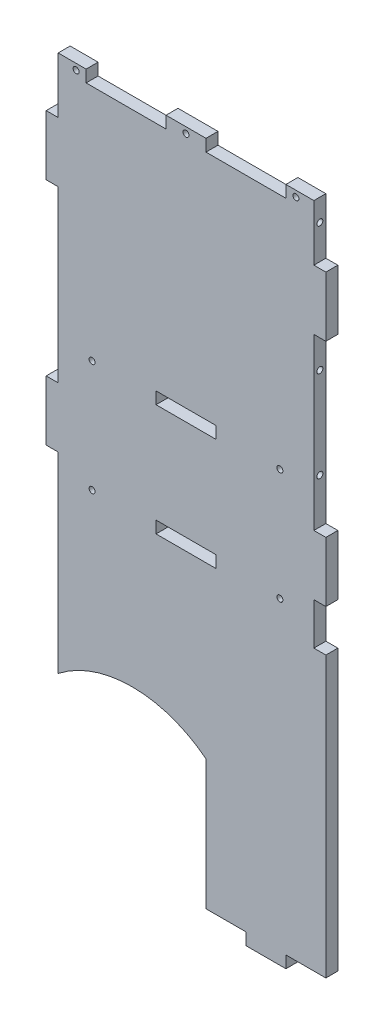
from build123d import *

# Parameters (mm, degrees)
ESQUISSE1_W              = 140
ESQUISSE1_H              = 340
ESQUISSE1_R              = 1.5
ESQUISSE1_W_2            = 30
ESQUISSE1_H_2            = 6
BOSS_EXTRU_3_DEPTH       = 6
ESQUISSE4_W              = 6
ESQUISSE4_H              = 28
ESQUISSE4_H_2            = 85
ESQUISSE4_H_3            = 51
ESQUISSE4_H_4            = 21
ENL_V_MAT_EXTRU_2_DEPTH  = 6
ESQUISSE5_R              = 1.5
ENL_V_MAT_EXTRU_3_DEPTH  = 9
ENL_V_START              = -3
ESQUISSE6_R              = 1.5
ENL_V_MAT_EXTRU_6_DEPTH  = 3
ESQUISSE7_W              = 20
ESQUISSE7_H              = 6
ENL_V_MAT_EXTRU_7_DEPTH  = 10
ENL_V_MAT_EXTRU_8_DEPTH  = 6
ESQUISSE9_W              = 40
ESQUISSE9_H              = 6
ENL_V_MAT_EXTRU_9_DEPTH  = 6
ESQUISSE10_R             = 1.5
ESQUISSE10_W             = 30
ESQUISSE10_H             = 6
ENL_V_MAT_EXTRU_10_DEPTH = 6


with BuildPart() as part:
    # Esquisse1 → Boss.-Extru.3 (new body)
    with BuildSketch(Plane.XY):
        with Locations((69.996437878, -101.21224042)):
            Rectangle(ESQUISSE1_W, ESQUISSE1_H)
        with Locations((14.996437878, 65.78775958)):
            Circle(ESQUISSE1_R, mode=Mode.SUBTRACT)
        with Locations((124.996437878, 65.78775958)):
            Circle(ESQUISSE1_R, mode=Mode.SUBTRACT)
        with Locations((69.996437878, 65.78775958)):
            Circle(ESQUISSE1_R, mode=Mode.SUBTRACT)
        with Locations((22.996437878, -112.21224042)):
            Circle(ESQUISSE1_R, mode=Mode.SUBTRACT)
        with Locations((116.996437878, -112.21224042)):
            Circle(ESQUISSE1_R, mode=Mode.SUBTRACT)
        with Locations((69.996437878, -112.21224042)):
            Rectangle(ESQUISSE1_W_2, ESQUISSE1_H_2, mode=Mode.SUBTRACT)
    extrude(amount=BOSS_EXTRU_3_DEPTH)

    # Esquisse4 → Enlèv. mat.-Extru.2 (cut)
    with BuildSketch(Plane.XY):
        with Locations((2.996437878, 54.78775958)):
            Rectangle(ESQUISSE4_W, ESQUISSE4_H)
        with Locations((2.996437878, -31.71224042)):
            Rectangle(ESQUISSE4_W, ESQUISSE4_H_2)
        with Locations((2.996437878, -129.71224042)):
            Rectangle(ESQUISSE4_W, ESQUISSE4_H_3)
        with Locations((136.996437878, -114.71224042)):
            Rectangle(ESQUISSE4_W, ESQUISSE4_H_4)
        with Locations((136.996437878, -31.71224042)):
            Rectangle(ESQUISSE4_W, ESQUISSE4_H_2)
        with Locations((136.996437878, 54.78775958)):
            Rectangle(ESQUISSE4_W, ESQUISSE4_H)
    extrude(amount=ENL_V_MAT_EXTRU_2_DEPTH, mode=Mode.SUBTRACT)

    # Esquisse5 → Enlèv. mat.-Extru.3 (cut)
    with BuildSketch(Plane(origin=(0, 0, 0), x_dir=(0, 0, -1), z_dir=(1, 0, 0))):
        with Locations(Location((-3, -126.71224042, 0), (0, 0, 270))):
            Circle(ESQUISSE5_R)
        with Locations(Location((-3, -51.71224042, 0), (0, 0, 270))):
            Circle(ESQUISSE5_R)
        with Locations(Location((-3, -6.21224042, 0), (0, 0, 270))):
            Circle(ESQUISSE5_R)
        with Locations(Location((-3, 57.78775958, 0), (0, 0, 270))):
            Circle(ESQUISSE5_R)
    extrude(amount=ENL_V_MAT_EXTRU_3_DEPTH, mode=Mode.SUBTRACT)

    # Esquisse6 → Enlèv. mat.-Extru.6 (cut)
    with BuildSketch(Plane(origin=(133.996437878, 0, 0), x_dir=(0, 0, -1), z_dir=(1, 0, 0)).offset(ENL_V_START)):
        with Locations(Location((-3, -6.21224042, 0), (0, 0, 270))):
            Circle(ESQUISSE6_R)
        with Locations(Location((-3, -51.71224042, 0), (0, 0, 270))):
            Circle(ESQUISSE6_R)
        with Locations(Location((-3, 57.78775958, 0), (0, 0, 270))):
            Circle(ESQUISSE6_R)
    extrude(amount=ENL_V_MAT_EXTRU_6_DEPTH, mode=Mode.SUBTRACT)

    # Esquisse7 → Enlèv. mat.-Extru.7 (cut)
    with BuildSketch(Plane.XY):
        with Locations((129.996437878, -268.21224042)):
            Rectangle(ESQUISSE7_W, ESQUISSE7_H)
        with Locations((89.996437878, -268.21224042)):
            Rectangle(ESQUISSE7_W, ESQUISSE7_H)
    extrude(amount=ENL_V_MAT_EXTRU_7_DEPTH, mode=Mode.SUBTRACT)

    # Esquisse8 → Enlèv. mat.-Extru.8 (cut)
    with BuildSketch(Plane.XY.offset(6)):
        with BuildLine():
            Line((79.996437878, -265.21224042), (79.996437878, -200.21224042))
            ThreePointArc((79.996437878, -200.21224042), (42.996437878, -187.445703134), (5.996437878, -200.21224042))
            Line((5.996437878, -200.21224042), (5.996437878, -155.21224042))
            Line((5.996437878, -155.21224042), (-0.003562122, -155.21224042))
            Line((-0.003562122, -155.21224042), (-0.003562122, -271.21224042))
            Line((-0.003562122, -271.21224042), (79.996437878, -271.21224042))
            Line((79.996437878, -271.21224042), (79.996437878, -265.21224042))
        make_face()
    extrude(amount=-ENL_V_MAT_EXTRU_8_DEPTH, mode=Mode.SUBTRACT)

    # Esquisse9 → Enlèv. mat.-Extru.9 (cut)
    with BuildSketch(Plane.XY.offset(6)):
        with Locations((39.996437878, 65.78775958)):
            Rectangle(ESQUISSE9_W, ESQUISSE9_H)
        with Locations((99.996437878, 65.78775958)):
            Rectangle(ESQUISSE9_W, ESQUISSE9_H)
    extrude(amount=-ENL_V_MAT_EXTRU_9_DEPTH, mode=Mode.SUBTRACT)

    # Esquisse10 → Enlèv. mat.-Extru.10 (cut)
    with BuildSketch(Plane(origin=(0, 0, 0), x_dir=(-1, 0, 0), z_dir=(0, 0, -1))):
        with Locations((-116.996437878, -56.21224042)):
            Circle(ESQUISSE10_R)
        with Locations((-22.996437878, -56.21224042)):
            Circle(ESQUISSE10_R)
        with Locations((-69.996437878, -56.21224042)):
            Rectangle(ESQUISSE10_W, ESQUISSE10_H)
    extrude(amount=-ENL_V_MAT_EXTRU_10_DEPTH, mode=Mode.SUBTRACT)


solid = part.part
